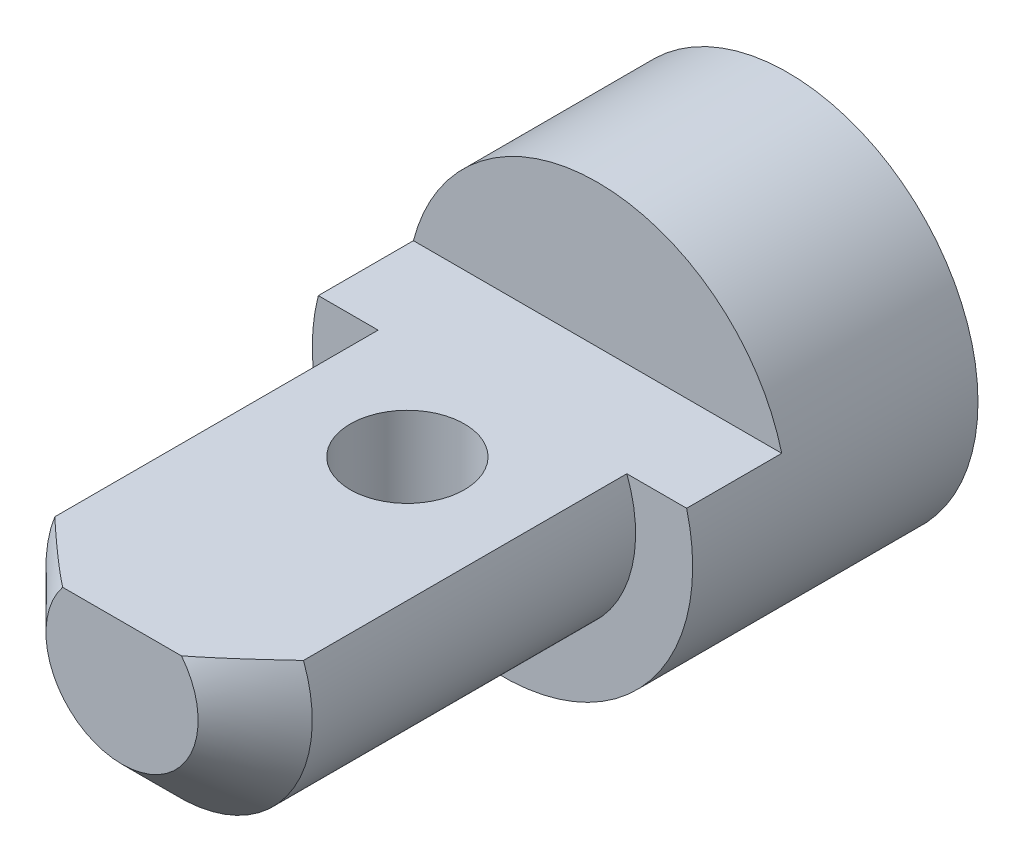
from build123d import *

# Parameters (mm, degrees)
SKETCH1_R           = 20
BOSS_EXTRUDE1_DEPTH = 20
BOSS_EXTRUDE2_START = 10
BOSS_EXTRUDE2_DEPTH = 10
BOSS_EXTRUDE3_START = 50
BOSS_EXTRUDE3_DEPTH = 50
CHAMFER3_SIZE       = 6
SKETCH3_R           = 6
CUT_EXTRUDE1_DEPTH  = 50


with BuildPart() as part:
    # Sketch1 → Boss-Extrude1 (new body)
    with BuildSketch(Plane.XY):
        Circle(SKETCH1_R)
    extrude(amount=-BOSS_EXTRUDE1_DEPTH)

    # Sketch1<4> → Boss-Extrude2 (add)
    with BuildSketch(Plane.XY.offset(BOSS_EXTRUDE2_START)):
        with BuildLine():
            Line((-13.076696831, 5), (-19.364916731, 5))
            ThreePointArc((-19.364916731, 5), (-2.52008585, -19.840593925), (20, 0))
            ThreePointArc((20, 0), (19.840593925, 2.52008585), (19.364916731, 5))
            Line((19.364916731, 5), (13.076696831, 5))
            ThreePointArc((13.076696831, 5), (13.767239295, 2.542267135), (14, 0))
            ThreePointArc((14, 0), (-2.542267135, -13.767239295), (-13.076696831, 5))
        make_face()
    extrude(amount=-BOSS_EXTRUDE2_DEPTH)

    # Sketch1<5> → Boss-Extrude3 (add)
    with BuildSketch(Plane.XY.offset(BOSS_EXTRUDE3_START)):
        with BuildLine():
            Line((13.076696831, 5), (-13.076696831, 5))
            ThreePointArc((-13.076696831, 5), (-2.542267135, -13.767239295), (14, 0))
            ThreePointArc((14, 0), (13.767239295, 2.542267135), (13.076696831, 5))
        make_face()
    extrude(amount=-BOSS_EXTRUDE3_DEPTH)

    # Chamfer3
    chamfer3_edges = [part.edges().sort_by_distance(p)[0] for p in [
        (-2.542267135, -13.767239295, 50),
    ]]
    chamfer(chamfer3_edges, length=CHAMFER3_SIZE)

    # Sketch3 → Cut-Extrude1 (cut)
    with BuildSketch(Plane(origin=(0, 5, 0), x_dir=(1, 0, 0), z_dir=(0, 1, 0))):
        with Locations((0, -20)):
            Circle(SKETCH3_R)
    extrude(amount=-CUT_EXTRUDE1_DEPTH, mode=Mode.SUBTRACT)


solid = part.part
